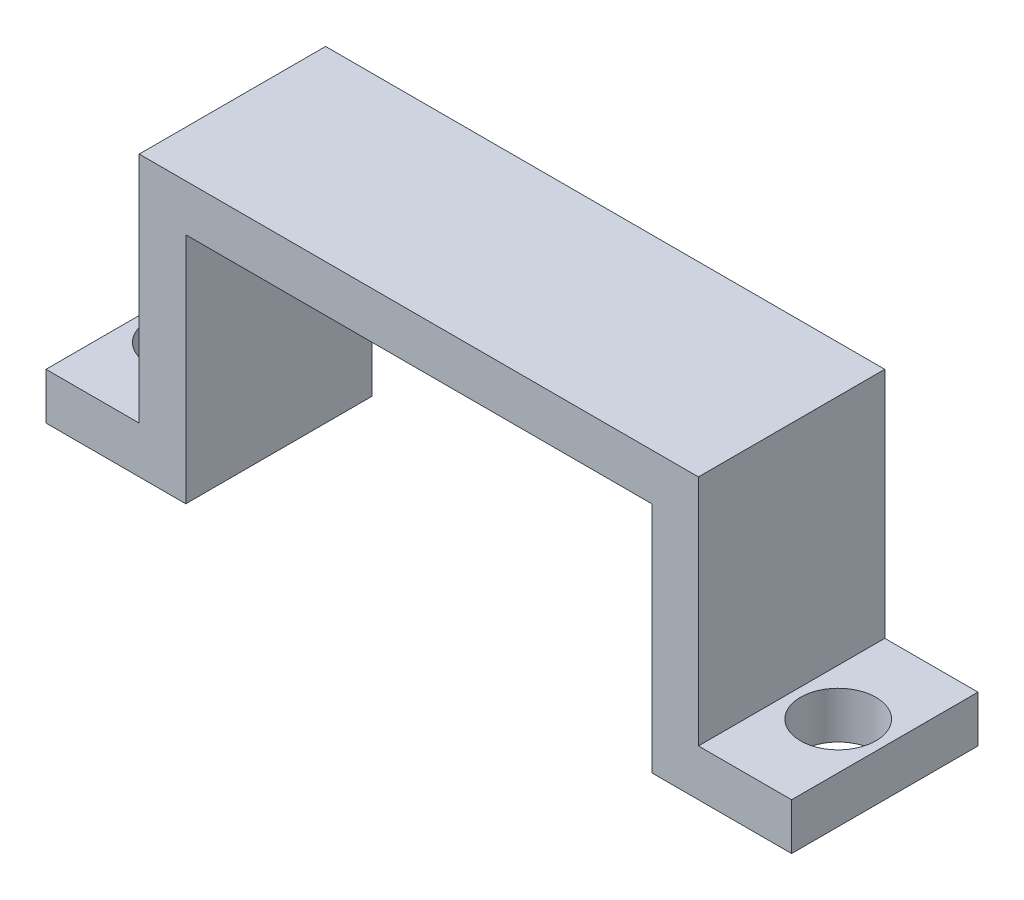
from build123d import *

# Parameters (mm, degrees)
SKETCH1_W           = 60
SKETCH1_H           = 20
BOSS_EXTRUDE1_DEPTH = 5
SKETCH2_W           = 5
SKETCH2_H           = 20
BOSS_EXTRUDE2_DEPTH = 25
SKETCH3_W           = 20
SKETCH3_H           = 5
BOSS_EXTRUDE3_DEPTH = 10
SKETCH4_W           = 20
SKETCH4_H           = 5
BOSS_EXTRUDE4_DEPTH = 10
SKETCH5_R           = 4.05
CUT_EXTRUDE1_DEPTH  = 20


with BuildPart() as part:
    # Sketch1 → Boss-Extrude1 (new body)
    with BuildSketch(Plane(origin=(0, 0, 0), x_dir=(1, 0, 0), z_dir=(0, 1, 0))):
        with Locations((30, 10)):
            Rectangle(SKETCH1_W, SKETCH1_H)
    extrude(amount=BOSS_EXTRUDE1_DEPTH)

    # Sketch2 → Boss-Extrude2 (add)
    with BuildSketch(Plane.XZ):
        with Locations((2.5, -10)):
            Rectangle(SKETCH2_W, SKETCH2_H)
        with Locations((57.5, -10)):
            Rectangle(SKETCH2_W, SKETCH2_H)
    extrude(amount=BOSS_EXTRUDE2_DEPTH)

    # Sketch3 → Boss-Extrude3 (add)
    with BuildSketch(Plane(origin=(60, 0, 0), x_dir=(0, 0, -1), z_dir=(1, 0, 0))):
        with Locations((10, -22.5)):
            Rectangle(SKETCH3_W, SKETCH3_H)
    extrude(amount=BOSS_EXTRUDE3_DEPTH)

    # Sketch4 → Boss-Extrude4 (add)
    with BuildSketch(Plane.ZY):
        with Locations((-10, -22.5)):
            Rectangle(SKETCH4_W, SKETCH4_H)
    extrude(amount=BOSS_EXTRUDE4_DEPTH)

    # Sketch5 → Cut-Extrude1 (cut)
    with BuildSketch(Plane(origin=(0, -20, 0), x_dir=(1, 0, 0), z_dir=(0, 1, 0))):
        with BuildLine():
            ThreePointArc((60.95, 10), (65, 5.95), (69.05, 10))
            Line((69.05, 10), (60.95, 10))
        make_face()
        with BuildLine():
            Line((60.95, 10), (69.05, 10))
            ThreePointArc((69.05, 10), (65, 14.05), (60.95, 10))
        make_face()
        with Locations(Location((-5, 10, 0), (0, 0, 270))):
            Circle(SKETCH5_R)
    extrude(amount=-CUT_EXTRUDE1_DEPTH, mode=Mode.SUBTRACT)


solid = part.part
